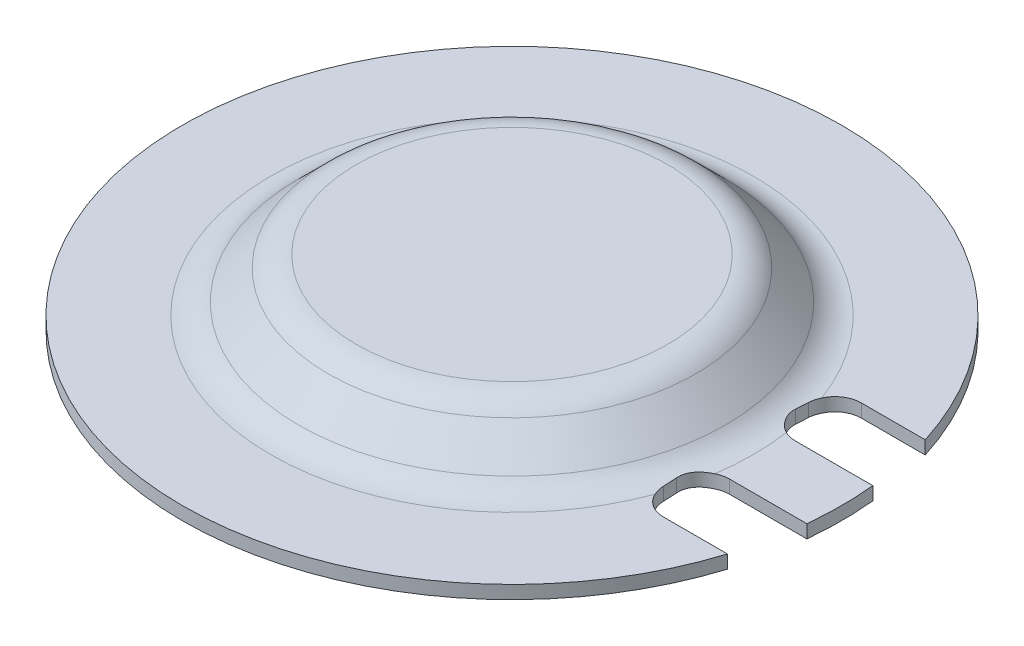
from build123d import *

# Parameters (mm, degrees)
CUT_EXTRUDE1_DEPTH = 5.582296376


with BuildPart() as part:
    # Sketch1 → Revolve2 (revolve)
    with BuildSketch(Plane.XY, mode=Mode.PRIVATE) as revolve2_sk:
        with BuildLine():
            Line((1.432534745, 7.84625121), (-0.067914271, 7.84625121))
            Line((-0.067914271, 7.84625121), (-0.067914271, 7.73195121))
            Line((-0.067914271, 7.73195121), (1.432534745, 7.73195121))
            ThreePointArc((1.432534745, 7.73195121), (1.534596416, 7.711649881), (1.621120123, 7.653836588))
            Line((1.621120123, 7.653836588), (1.90593549, 7.369021221))
            ThreePointArc((1.90593549, 7.369021221), (2.065565133, 7.255760643), (2.256165479, 7.21125121))
            Line((2.256165479, 7.21125121), (3.106859566, 7.21125121))
            Line((3.106859566, 7.21125121), (3.106859566, 7.33825121))
            Line((3.106859566, 7.33825121), (2.256165479, 7.33825121))
            ThreePointArc((2.256165479, 7.33825121), (2.110363091, 7.367253108), (1.986757795, 7.449843526))
            Line((1.986757795, 7.449843526), (1.701942428, 7.734658893))
            ThreePointArc((1.701942428, 7.734658893), (1.578337132, 7.817249312), (1.432534745, 7.84625121))
        make_face()
    revolve(revolve2_sk.sketch.rotate(Axis((-0.067914271, 7.84625121, 0), (0, -1, 0)), 90), axis=Axis((-0.067914271, 7.84625121, 0), (0, -1, 0)))

    # Sketch2 → Cut-Extrude1 (cut, through all)
    with BuildSketch(Plane.XZ.offset(-7.21125121)):
        with BuildLine():
            Line((2.090859566, -0.5715), (2.090859566, -0.6985))
            ThreePointArc((2.090859566, -0.6985), (2.165254443, -0.878105122), (2.344859566, -0.9525))
            Line((2.344859566, -0.9525), (3.634475543, -0.9525))
            Line((3.634475543, -0.9525), (3.634475543, -0.3175))
            Line((3.634475543, -0.3175), (2.344859566, -0.3175))
            ThreePointArc((2.344859566, -0.3175), (2.165254443, -0.391894878), (2.090859566, -0.5715))
        make_face()
        with BuildLine():
            Line((2.344859566, 0.9525), (3.634475543, 0.9525))
            Line((3.634475543, 0.9525), (3.634475543, 0.3175))
            Line((3.634475543, 0.3175), (2.344859566, 0.3175))
            ThreePointArc((2.344859566, 0.3175), (2.165254443, 0.391894878), (2.090859566, 0.5715))
            Line((2.090859566, 0.5715), (2.090859566, 0.6985))
            ThreePointArc((2.090859566, 0.6985), (2.165254443, 0.878105122), (2.344859566, 0.9525))
        make_face()
    extrude(amount=-CUT_EXTRUDE1_DEPTH, mode=Mode.SUBTRACT)


solid = part.part
